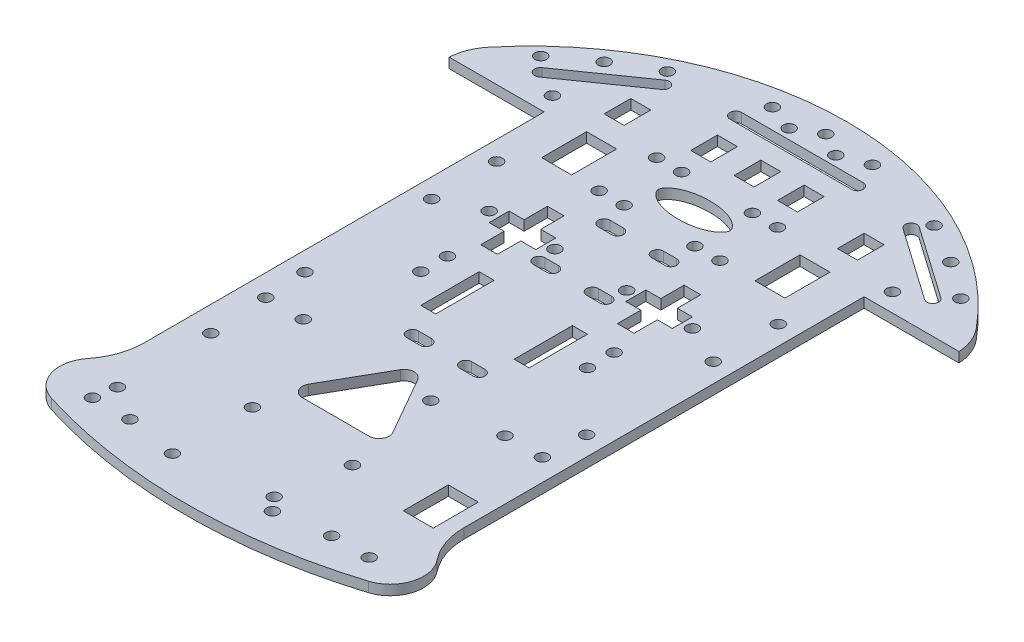
from build123d import *

# Parameters (mm, degrees)
SKETCH1_R           = 1.75
SKETCH1_W           = 4.5
SKETCH1_H           = 17.5
SKETCH1_W_2         = 9
SKETCH1_H_2         = 13.5
SKETCH1_W_3         = 6
SKETCH1_H_3         = 8
BOSS_EXTRUDE1_DEPTH = 3


with BuildPart() as part:
    # Sketch1 → Boss-Extrude1 (new body)
    with BuildSketch(Plane.XZ.offset(1.5)):
        with BuildLine():
            Line((-48, 0), (-76.5, 0))
            ThreePointArc((-76.5, 0), (-75.463407738, -4.563637411), (-73.070877413, -8.585715057))
            ThreePointArc((-73.070877413, -8.585715057), (0, -42.876186364), (73.070877413, -8.585715057))
            ThreePointArc((73.070877413, -8.585715057), (75.463407738, -4.563637411), (76.5, 0))
            Line((76.5, 0), (48, 0))
            Line((48, 0), (48, 120))
            ThreePointArc((48, 120), (49.125547892, 126.614760587), (52.375505763, 132.484998191))
            ThreePointArc((52.375505763, 132.484998191), (54.124006019, 141.65872734), (47.534142554, 148.275997106))
            ThreePointArc((47.534142554, 148.275997106), (0, 155.5), (-47.534142554, 148.275997106))
            ThreePointArc((-47.534142554, 148.275997106), (-54.124006019, 141.65872734), (-52.375505763, 132.484998191))
            ThreePointArc((-52.375505763, 132.484998191), (-49.125547892, 126.614760587), (-48, 120))
            Line((-48, 120), (-48, 0))
        make_face()
        with Locations((-7, -32.5)):
            Circle(SKETCH1_R, mode=Mode.SUBTRACT)
        with Locations((0, -36.5)):
            Circle(SKETCH1_R, mode=Mode.SUBTRACT)
        with Locations((7, -32.5)):
            Circle(SKETCH1_R, mode=Mode.SUBTRACT)
        with Locations((15, -35.5)):
            Circle(SKETCH1_R, mode=Mode.SUBTRACT)
        with Locations((-15, -35.5)):
            Circle(SKETCH1_R, mode=Mode.SUBTRACT)
        with Locations((-40, -29)):
            Circle(SKETCH1_R, mode=Mode.SUBTRACT)
        with Locations((-52, -22)):
            Circle(SKETCH1_R, mode=Mode.SUBTRACT)
        with Locations((-63, -14)):
            Circle(SKETCH1_R, mode=Mode.SUBTRACT)
        with Locations((63, -14)):
            Circle(SKETCH1_R, mode=Mode.SUBTRACT)
        with Locations((52, -22)):
            Circle(SKETCH1_R, mode=Mode.SUBTRACT)
        with Locations((40, -29)):
            Circle(SKETCH1_R, mode=Mode.SUBTRACT)
        with Locations((-19.25, -5)):
            Circle(SKETCH1_R, mode=Mode.SUBTRACT)
        with Locations((-11.75, -5)):
            Circle(SKETCH1_R, mode=Mode.SUBTRACT)
        with Locations((-11.75, 12.25)):
            Circle(SKETCH1_R, mode=Mode.SUBTRACT)
        with Locations((-19.25, 12.25)):
            Circle(SKETCH1_R, mode=Mode.SUBTRACT)
        with Locations((9.5, 12.25)):
            Circle(SKETCH1_R, mode=Mode.SUBTRACT)
        with Locations((17, 12.25)):
            Circle(SKETCH1_R, mode=Mode.SUBTRACT)
        with Locations((17, -5)):
            Circle(SKETCH1_R, mode=Mode.SUBTRACT)
        with Locations((9.5, -5)):
            Circle(SKETCH1_R, mode=Mode.SUBTRACT)
        with Locations((-51, -5.5)):
            Circle(SKETCH1_R, mode=Mode.SUBTRACT)
        with Locations((-42.25, 20)):
            Circle(SKETCH1_R, mode=Mode.SUBTRACT)
        with Locations((42.25, 20)):
            Circle(SKETCH1_R, mode=Mode.SUBTRACT)
        with Locations((51, -5.5)):
            Circle(SKETCH1_R, mode=Mode.SUBTRACT)
        with Locations((-10.75, 34)):
            Circle(SKETCH1_R, mode=Mode.SUBTRACT)
        with Locations((-30.5, 34)):
            Circle(SKETCH1_R, mode=Mode.SUBTRACT)
        with Locations((10.75, 34)):
            Circle(SKETCH1_R, mode=Mode.SUBTRACT)
        with Locations((30.5, 34)):
            Circle(SKETCH1_R, mode=Mode.SUBTRACT)
        with Locations((42.25, 39.5)):
            Circle(SKETCH1_R, mode=Mode.SUBTRACT)
        with Locations((25, 52)):
            Circle(SKETCH1_R, mode=Mode.SUBTRACT)
        with Locations((25, 60)):
            Circle(SKETCH1_R, mode=Mode.SUBTRACT)
        with Locations((-25, 60)):
            Circle(SKETCH1_R, mode=Mode.SUBTRACT)
        with Locations((-25, 52)):
            Circle(SKETCH1_R, mode=Mode.SUBTRACT)
        with Locations((-42.25, 39.5)):
            Circle(SKETCH1_R, mode=Mode.SUBTRACT)
        with Locations((-42.25, 77.498287595)):
            Circle(SKETCH1_R, mode=Mode.SUBTRACT)
        with Locations((-41.5, 90)):
            Circle(SKETCH1_R, mode=Mode.SUBTRACT)
        with Locations((-30.25, 90)):
            Circle(SKETCH1_R, mode=Mode.SUBTRACT)
        with Locations((-40.5, 107.5)):
            Circle(SKETCH1_R, mode=Mode.SUBTRACT)
        with Locations((-15, 120.5)):
            Circle(SKETCH1_R, mode=Mode.SUBTRACT)
        with Locations((-40.5, 135.5)):
            Circle(SKETCH1_R, mode=Mode.SUBTRACT)
        with Locations((-41.5, 142)):
            Circle(SKETCH1_R, mode=Mode.SUBTRACT)
        with Locations((-30.25, 142)):
            Circle(SKETCH1_R, mode=Mode.SUBTRACT)
        with Locations((-15, 144.5)):
            Circle(SKETCH1_R, mode=Mode.SUBTRACT)
        with Locations((11.5, 140.5)):
            Circle(SKETCH1_R, mode=Mode.SUBTRACT)
        with Locations((15, 144.5)):
            Circle(SKETCH1_R, mode=Mode.SUBTRACT)
        with Locations((30.25, 142)):
            Circle(SKETCH1_R, mode=Mode.SUBTRACT)
        with Locations((41.5, 142)):
            Circle(SKETCH1_R, mode=Mode.SUBTRACT)
        with Locations((15, 120.5)):
            Circle(SKETCH1_R, mode=Mode.SUBTRACT)
        with Locations((10, 92)):
            Circle(SKETCH1_R, mode=Mode.SUBTRACT)
        with Locations((30.25, 90)):
            Circle(SKETCH1_R, mode=Mode.SUBTRACT)
        with Locations((41.5, 90)):
            Circle(SKETCH1_R, mode=Mode.SUBTRACT)
        with Locations((42.25, 77.498287595)):
            Circle(SKETCH1_R, mode=Mode.SUBTRACT)
        with BuildLine():
            Line((6, 21.75), (10, 21.75))
            ThreePointArc((10, 21.75), (11.75, 20), (10, 18.25))
            Line((10, 18.25), (6, 18.25))
            ThreePointArc((6, 18.25), (4.25, 20), (6, 21.75))
        make_face(mode=Mode.SUBTRACT)
        with BuildLine():
            Line((-10, 41.25), (-6, 41.25))
            ThreePointArc((-6, 41.25), (-4.25, 39.5), (-6, 37.75))
            Line((-6, 37.75), (-10, 37.75))
            ThreePointArc((-10, 37.75), (-11.75, 39.5), (-10, 41.25))
        make_face(mode=Mode.SUBTRACT)
        with BuildLine():
            Line((6, 79.25), (10, 79.25))
            ThreePointArc((10, 79.25), (11.75, 77.5), (10, 75.75))
            Line((10, 75.75), (6, 75.75))
            ThreePointArc((6, 75.75), (4.25, 77.5), (6, 79.25))
        make_face(mode=Mode.SUBTRACT)
        with BuildLine():
            Line((-10, 110.5), (10, 110.5))
            ThreePointArc((10, 110.5), (12.594730279, 109.005780455), (12.604729426, 106.011583185))
            Line((12.604729426, 106.011583185), (2.604729426, 88.511583185))
            ThreePointArc((2.604729426, 88.511583185), (0, 87), (-2.604729426, 88.511583185))
            Line((-2.604729426, 88.511583185), (-12.604729426, 106.011583185))
            ThreePointArc((-12.604729426, 106.011583185), (-12.594730279, 109.005780455), (-10, 110.5))
        make_face(mode=Mode.SUBTRACT)
        with BuildLine():
            Line((-57.850005823, -8.316483922), (-36.14247665, -23.516259486))
            ThreePointArc((-36.14247665, -23.516259486), (-35.712719336, -25.953534327), (-38.149994177, -26.383291641))
            Line((-38.149994177, -26.383291641), (-59.85752335, -11.183516078))
            ThreePointArc((-59.85752335, -11.183516078), (-60.287280664, -8.746241236), (-57.850005823, -8.316483922))
        make_face(mode=Mode.SUBTRACT)
        Polygon((23, 44), (23, 37), (27.5, 37), (27.5, 31), (23, 31), (23, 24), (18, 24), (18, 31), (13.5, 31), (13.5, 37), (18, 37), (18, 44), align=None, mode=Mode.SUBTRACT)
        with Locations((14, 60)):
            Rectangle(SKETCH1_W, SKETCH1_H, mode=Mode.SUBTRACT)
        with Locations((39, 118)):
            Rectangle(SKETCH1_W_2, SKETCH1_H_2, mode=Mode.SUBTRACT)
        with Locations((-32, 5.5)):
            Rectangle(SKETCH1_W_2, SKETCH1_H_2, mode=Mode.SUBTRACT)
        with Locations((13, -16)):
            Rectangle(SKETCH1_W_3, SKETCH1_H_3, mode=Mode.SUBTRACT)
        with Locations((34.5, -12.5)):
            Rectangle(SKETCH1_W_3, SKETCH1_H_3, mode=Mode.SUBTRACT)
        with Locations((-35.5, -12.5)):
            Rectangle(SKETCH1_W_3, SKETCH1_H_3, mode=Mode.SUBTRACT)
        with Locations((-13, -16)):
            Rectangle(SKETCH1_W_3, SKETCH1_H_3, mode=Mode.SUBTRACT)
        with Locations((0, -16)):
            Rectangle(SKETCH1_W_3, SKETCH1_H_3, mode=Mode.SUBTRACT)
        with Locations((32, 5.5)):
            Rectangle(SKETCH1_W_2, SKETCH1_H_2, mode=Mode.SUBTRACT)
        with Locations((-14, 60)):
            Rectangle(SKETCH1_W, SKETCH1_H, mode=Mode.SUBTRACT)
        Polygon((-18, 44), (-18, 37), (-13.5, 37), (-13.5, 31), (-18, 31), (-18, 24), (-23, 24), (-23, 31), (-27.5, 31), (-27.5, 37), (-23, 37), (-23, 44), align=None, mode=Mode.SUBTRACT)
        with BuildLine():
            Line((-18.25, -26), (18.25, -26))
            ThreePointArc((18.25, -26), (20, -27.75), (18.25, -29.5))
            Line((18.25, -29.5), (-18.25, -29.5))
            ThreePointArc((-18.25, -29.5), (-20, -27.75), (-18.25, -26))
        make_face(mode=Mode.SUBTRACT)
        with BuildLine():
            Line((59.85752335, -11.183516078), (38.149994177, -26.383291641))
            ThreePointArc((38.149994177, -26.383291641), (35.712719336, -25.953534327), (36.14247665, -23.516259486))
            Line((36.14247665, -23.516259486), (57.850005823, -8.316483922))
            ThreePointArc((57.850005823, -8.316483922), (60.287280664, -8.746241236), (59.85752335, -11.183516078))
        make_face(mode=Mode.SUBTRACT)
        with BuildLine():
            Line((-10, 79.25), (-6, 79.25))
            ThreePointArc((-6, 79.25), (-4.25, 77.5), (-6, 75.75))
            Line((-6, 75.75), (-10, 75.75))
            ThreePointArc((-10, 75.75), (-11.75, 77.5), (-10, 79.25))
        make_face(mode=Mode.SUBTRACT)
        with BuildLine():
            Line((6, 41.25), (10, 41.25))
            ThreePointArc((10, 41.25), (11.75, 39.5), (10, 37.75))
            Line((10, 37.75), (6, 37.75))
            ThreePointArc((6, 37.75), (4.25, 39.5), (6, 41.25))
        make_face(mode=Mode.SUBTRACT)
        with BuildLine():
            Line((-10, 21.75), (-6, 21.75))
            ThreePointArc((-6, 21.75), (-4.25, 20), (-6, 18.25))
            Line((-6, 18.25), (-10, 18.25))
            ThreePointArc((-10, 18.25), (-11.75, 20), (-10, 21.75))
        make_face(mode=Mode.SUBTRACT)
        with BuildLine():
            add(Edge.make_bspline(
                [(10.75, 3), (10.75, 4.583333333), (7.166666667, 7.75), (-7.166666667, 7.75), (-10.75, 4.583333333), (-10.75, 3)],
                knots=[0, 0, 0, 0, 0.5, 0.5, 1, 1, 1, 1], degree=3))
            add(Edge.make_bspline(
                [(-10.75, 3), (-10.75, 1.416666667), (-7.166666667, -1.75), (7.166666667, -1.75), (10.75, 1.416666667), (10.75, 3)],
                knots=[0, 0, 0, 0, 0.5, 0.5, 1, 1, 1, 1], degree=3))
        make_face(mode=Mode.SUBTRACT)
    extrude(amount=-BOSS_EXTRUDE1_DEPTH)


solid = part.part
